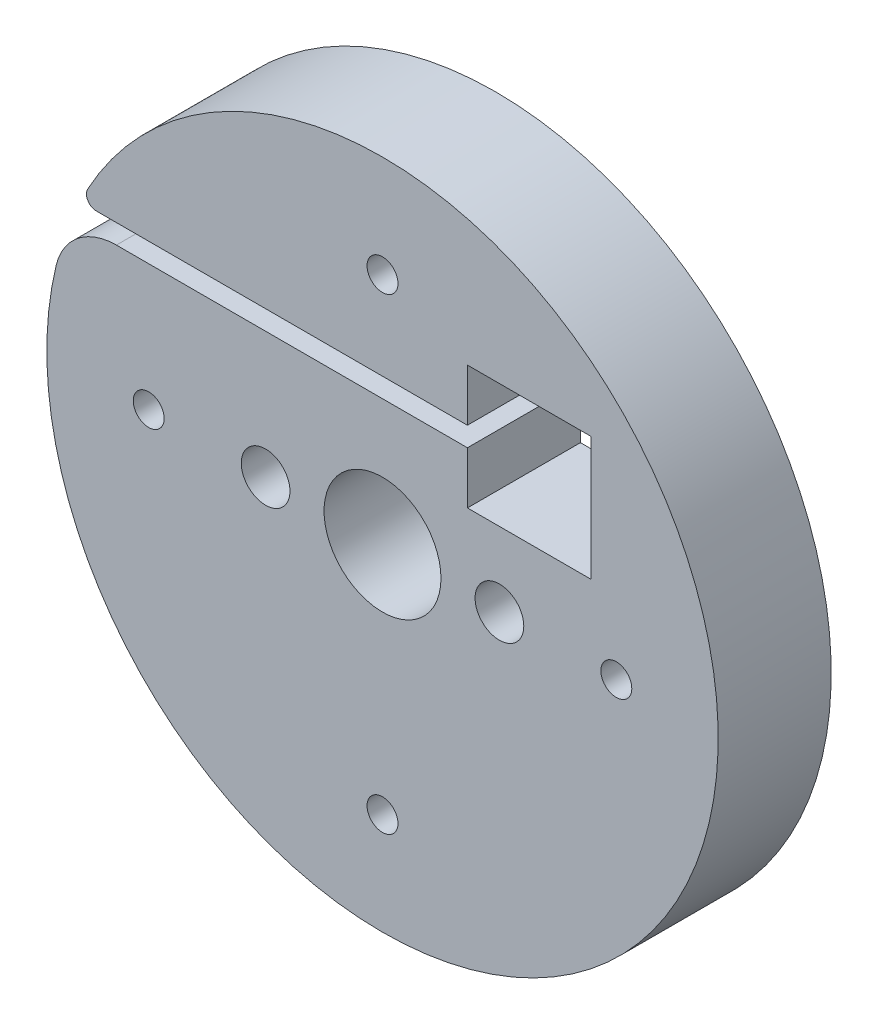
from build123d import *

# Parameters (mm, degrees)
SKETCH1_R                 = 17.229166667
SKETCH1_R_2               = 3
BOSS_EXTRUDE1_DEPTH       = 5.8
SKETCH2_R                 = 0.79375
CUT_EXTRUDE1_DEPTH        = 26.046524071
CUT_EXTRUDE2_DEPTH        = 26.046524071
FILLET1_R                 = 3.175
FILLET2_R                 = 0.508
M3X0_5_TAPPED_HOLE1_D     = 2.5
M3X0_5_TAPPED_HOLE1_DEPTH = 8.636
M3X0_5_TAPPED_HOLE1_TIP   = 0.751075774


with BuildPart() as part:
    # Sketch1 → Boss-Extrude1 (new body)
    with BuildSketch(Plane.XY):
        Circle(SKETCH1_R)
        Circle(SKETCH1_R_2, mode=Mode.SUBTRACT)
    extrude(amount=BOSS_EXTRUDE1_DEPTH)

    # Sketch2 → Cut-Extrude1 (cut, through all)
    with BuildSketch(Plane.XY.offset(5.8)):
        with Locations((0, 12)):
            Circle(SKETCH2_R)
        with Locations((12, 0)):
            Circle(SKETCH2_R)
        with Locations((0, -12)):
            Circle(SKETCH2_R)
        with Locations((-12, 0)):
            Circle(SKETCH2_R)
    extrude(amount=-CUT_EXTRUDE1_DEPTH, mode=Mode.SUBTRACT)

    # Sketch3 → Cut-Extrude2 (cut, through all)
    with BuildSketch(Plane.XY.offset(5.8)):
        with BuildLine():
            Line((-15.518342664, 7.485), (4.357889894, 7.485))
            Line((4.357889894, 7.485), (4.357889894, 10.16))
            Line((4.357889894, 10.16), (10.707889894, 10.16))
            Line((10.707889894, 10.16), (10.707889894, 3.81))
            Line((10.707889894, 3.81), (4.357889894, 3.81))
            Line((4.357889894, 3.81), (4.357889894, 6.485))
            Line((4.357889894, 6.485), (-15.962110106, 6.485))
            ThreePointArc((-15.962110106, 6.485), (-15.748165818, 6.988523262), (-15.518342664, 7.485))
        make_face()
    extrude(amount=-CUT_EXTRUDE2_DEPTH, mode=Mode.SUBTRACT)

    # Fillet1
    fillet1_edges = [part.edges().sort_by_distance(p)[0] for p in [
        (-15.962110106, 6.485, 2.9),
    ]]
    fillet(fillet1_edges, radius=FILLET1_R)

    # Fillet2
    fillet2_edges = [part.edges().sort_by_distance(p)[0] for p in [
        (-15.518342664, 7.485, 2.9),
    ]]
    fillet(fillet2_edges, radius=FILLET2_R)

    # M3x0.5 Tapped Hole1
    with Locations(Plane.XY.offset(5.8)):
        with Locations((-6, 0), (6, 0)):
            Hole(M3X0_5_TAPPED_HOLE1_D / 2, depth=M3X0_5_TAPPED_HOLE1_DEPTH)
            with Locations((0, 0, -(M3X0_5_TAPPED_HOLE1_DEPTH + M3X0_5_TAPPED_HOLE1_TIP / 2))):  # 118° drill point
                Cone(0, M3X0_5_TAPPED_HOLE1_D / 2, M3X0_5_TAPPED_HOLE1_TIP, mode=Mode.SUBTRACT)


solid = part.part
